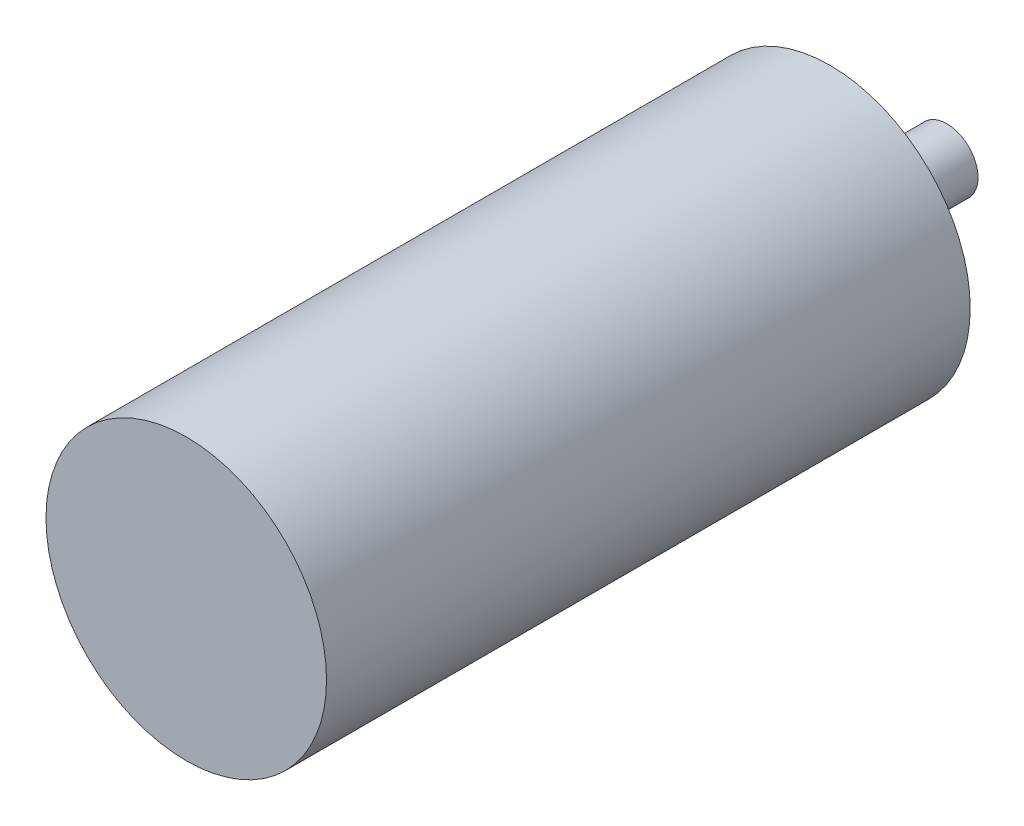
from build123d import *

# Parameters (mm, degrees)
SKETCH1_R           = 18
BOSS_EXTRUDE1_DEPTH = 82.6
SKETCH3_R           = 1.5
CUT_EXTRUDE1_DEPTH  = 5
SKETCH2_R           = 4
BOSS_EXTRUDE3_DEPTH = 15


with BuildPart() as part:
    # Sketch1 → Boss-Extrude1 (new body)
    with BuildSketch(Plane.XY):
        with Locations(Location((0, 0, 0), (0, 0, 180))):
            Circle(SKETCH1_R)
    extrude(amount=BOSS_EXTRUDE1_DEPTH)

    # Sketch3 → Cut-Extrude1 (cut)
    with BuildSketch(Plane(origin=(0, 0, 0), x_dir=(-1, 0, 0), z_dir=(0, 0, -1))):
        with Locations((0, 14)):
            Circle(SKETCH3_R)
        with Locations((14, 0)):
            Circle(SKETCH3_R)
        with Locations((0, -14)):
            Circle(SKETCH3_R)
        with Locations((-14, 0)):
            Circle(SKETCH3_R)
    extrude(amount=-CUT_EXTRUDE1_DEPTH, mode=Mode.SUBTRACT)

    # Sketch2 → Boss-Extrude3 (add)
    with BuildSketch(Plane(origin=(0, 0, 0), x_dir=(-1, 0, 0), z_dir=(0, 0, -1))):
        with Locations(Location((0, 0, 0), (0, 0, 180))):
            Circle(SKETCH2_R)
    extrude(amount=BOSS_EXTRUDE3_DEPTH)


solid = part.part
